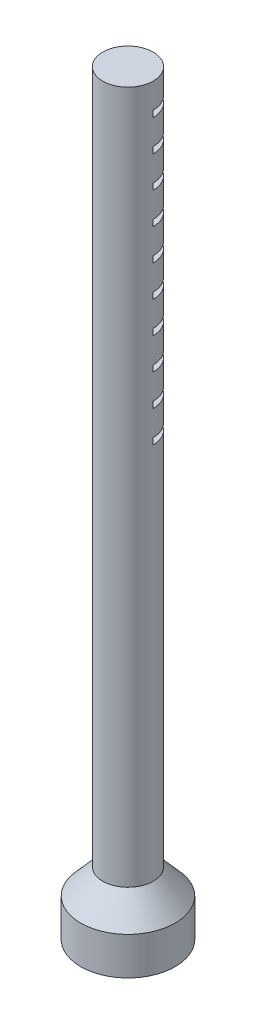
from build123d import *

# Parameters (mm, degrees)
CORTAR_EXTRUIR1_DEPTH = 46.56245087


with BuildPart() as part:
    # Croquis2 → Revolución1 (revolve)
    with BuildSketch(Plane.XY, mode=Mode.PRIVATE) as revoluci_n1_sk:
        Polygon((0, -14.74724396), (3.75, -14.74724396), (3.75, -11.74724396), (2, -9.74724396), (2, 45.25275604), (0, 45.25275604), align=None)
    revolve(revoluci_n1_sk.sketch.rotate(Axis((0, 34.083509453, 0), (0, -1, 0)), 90), axis=Axis((0, 34.083509453, 0), (0, -1, 0)))

    # Croquis3 → Cortar-Extruir1 (cut, through all)
    with BuildSketch(Plane.XY):
        Polygon((2, 45.25275604), (2, 43.25275604), (1.015724773, 43.25275604), (1.015724773, 42.75275604), (2, 42.75275604), (2, 40.75275604), (1.015724773, 40.75275604), (1.015724773, 40.25275604), (2, 40.25275604), (2, 38.25275604), (1.015724773, 38.25275604), (1.015724773, 37.75275604), (2, 37.75275604), (2, 35.75275604), (1.015724773, 35.75275604), (1.015724773, 35.25275604), (2, 35.25275604), (2, 33.25275604), (1.015724773, 33.25275604), (1.015724773, 32.75275604), (2, 32.75275604), (2, 30.75275604), (1.015724773, 30.75275604), (1.015724773, 30.25275604), (2, 30.25275604), (2, 28.25275604), (1.015724773, 28.25275604), (1.015724773, 27.75275604), (2, 27.75275604), (2, 25.75275604), (1.015724773, 25.75275604), (1.015724773, 25.25275604), (2, 25.25275604), (2, 23.25275604), (1.015724773, 23.25275604), (1.015724773, 22.75275604), (2, 22.75275604), (2, 20.75275604), (1.015724773, 20.75275604), (1.015724773, 20.25275604), (2, 20.25275604), (3.93485594, 20.25275604), (3.93485594, 45.25275604), align=None)
    extrude(amount=-CORTAR_EXTRUIR1_DEPTH, mode=Mode.SUBTRACT)


solid = part.part
